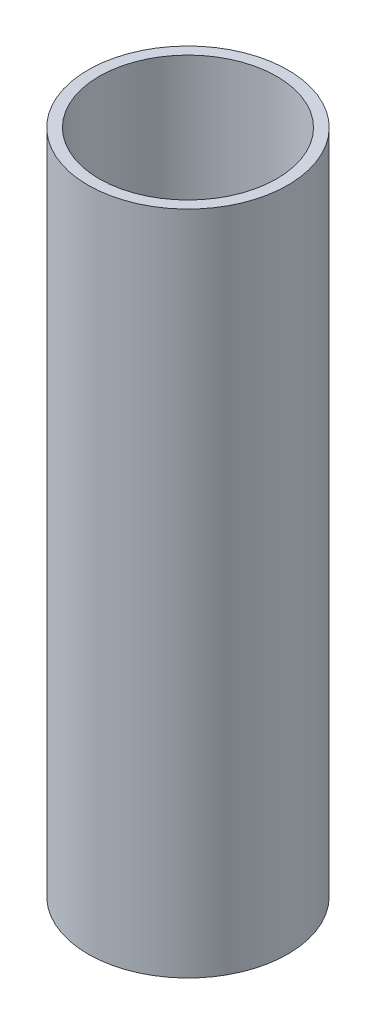
from build123d import *

# Parameters (mm, degrees)
SKETCH_1_R      = 9
SKETCH_1_R_2    = 8
EXTRUDE_2_DEPTH = 60


with BuildPart() as part:
    # 草图1 → 凸台-拉伸2 (new body)
    with BuildSketch(Plane(origin=(0, 0, 0), x_dir=(1, 0, 0), z_dir=(0, 1, 0))):
        with Locations(Location((0, 0, 0), (0, 0, 270))):
            Circle(SKETCH_1_R)
        with Locations(Location((0, 0, 0), (0, 0, 270))):
            Circle(SKETCH_1_R_2, mode=Mode.SUBTRACT)
    extrude(amount=EXTRUDE_2_DEPTH)


solid = part.part
